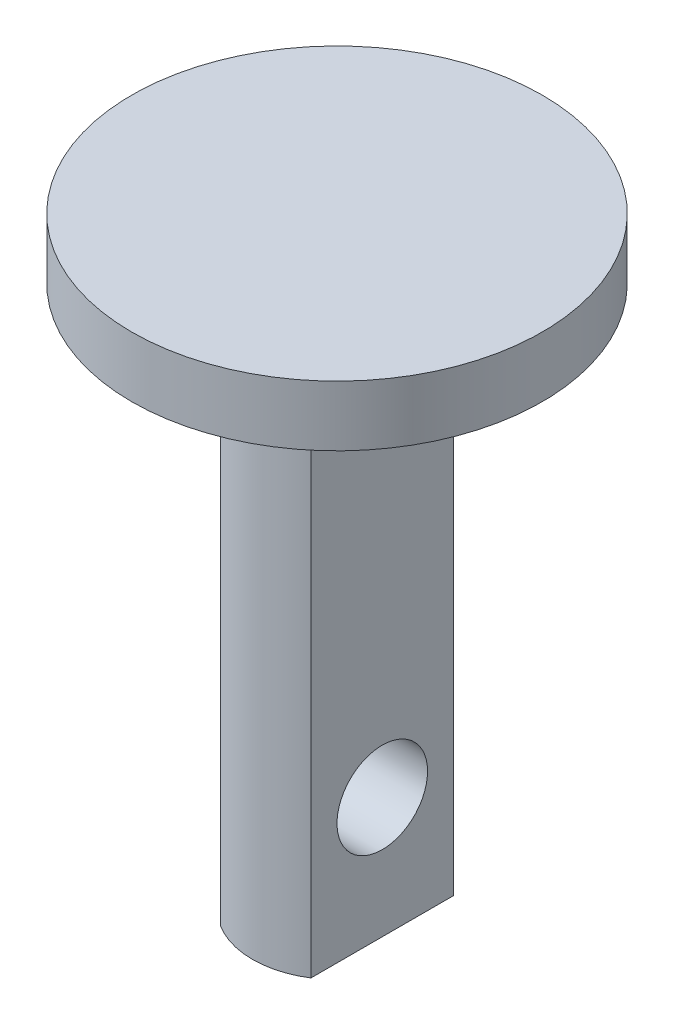
from build123d import *

# Parameters (mm, degrees)
SKETCH1_R           = 17
BOSS_EXTRUDE1_DEPTH = 5
BOSS_EXTRUDE2_START = -5
BOSS_EXTRUDE2_DEPTH = 45
SKETCH2_R           = 3.75
CUT_EXTRUDE1_DEPTH  = 57.741188743


with BuildPart() as part:
    # Sketch1 → Boss-Extrude1 (new body)
    with BuildSketch(Plane(origin=(0, 0, 0), x_dir=(1, 0, 0), z_dir=(0, 1, 0))):
        with Locations(Location((0, 0, 0), (0, 0, 270))):
            Circle(SKETCH1_R)
    extrude(amount=-BOSS_EXTRUDE1_DEPTH)

    # Sketch1<3> → Boss-Extrude2 (add)
    with BuildSketch(Plane(origin=(0, 0, 0), x_dir=(1, 0, 0), z_dir=(0, 1, 0)).offset(BOSS_EXTRUDE2_START)):
        with BuildLine():
            ThreePointArc((-3.75, -5.910795209), (0, -7), (3.75, -5.910795209))
            Line((3.75, -5.910795209), (3.75, 5.910795209))
            ThreePointArc((3.75, 5.910795209), (0, 7), (-3.75, 5.910795209))
            Line((-3.75, 5.910795209), (-3.75, -5.910795209))
        make_face()
    extrude(amount=-BOSS_EXTRUDE2_DEPTH)

    # Sketch2 → Cut-Extrude1 (cut, through all)
    with BuildSketch(Plane(origin=(3.75, 0, 0), x_dir=(0, 0, -1), z_dir=(1, 0, 0))):
        with Locations((0, -40)):
            Circle(SKETCH2_R)
    extrude(amount=-CUT_EXTRUDE1_DEPTH, mode=Mode.SUBTRACT)


solid = part.part
